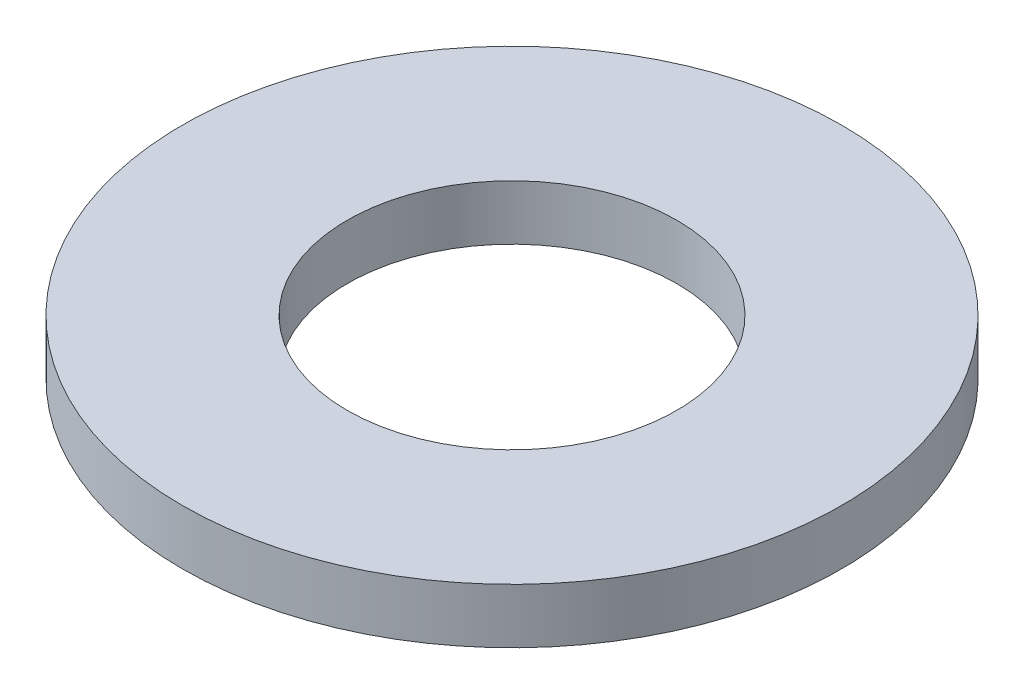
from build123d import *

# Parameters (mm, degrees)
SKETCH1_R           = 15.24
SKETCH1_R_2         = 7.62
BOSS_EXTRUDE1_DEPTH = 2.54


with BuildPart() as part:
    # Sketch1 → Boss-Extrude1 (new body)
    with BuildSketch(Plane(origin=(0, 0, 0), x_dir=(1, 0, 0), z_dir=(0, 1, 0))):
        with Locations(Location((0, 0, 0), (0, 0, 270))):
            Circle(SKETCH1_R)
        with Locations(Location((0, 0, 0), (0, 0, 270))):
            Circle(SKETCH1_R_2, mode=Mode.SUBTRACT)
    extrude(amount=BOSS_EXTRUDE1_DEPTH)


solid = part.part
